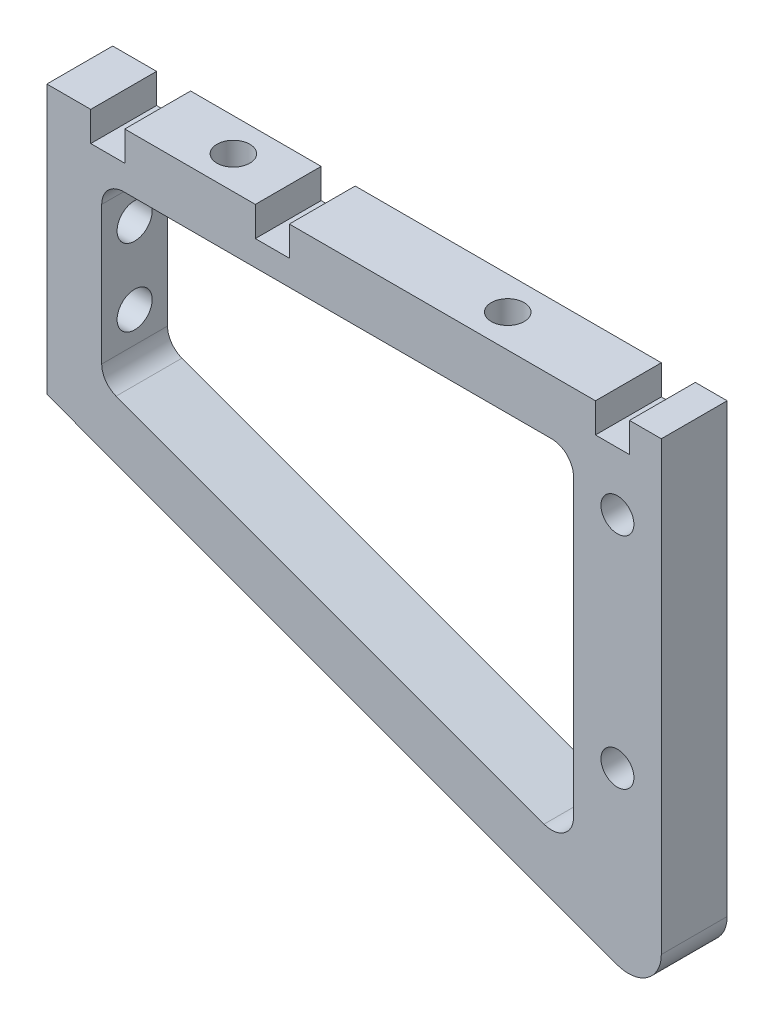
from build123d import *

# Parameters (mm, degrees)
SKETCH_1_R          = 1.5
EXTRUDE_1_DEPTH     = 6
FILLET_1_R          = 3
CUT_EXTRUDE_1_REACH = 73.29
SKETCH_2_R          = 1.5
SKETCH_3_W          = 3.1
SKETCH_3_H          = 2.7
CUT_EXTRUDE_2_DEPTH = 73.090221251
FILLET_2_R          = 2
SKETCH_4_R          = 1.6
CUT_EXTRUDE_3_DEPTH = 69.27884006


with BuildPart() as part:
    # 草图1 → 凸台-拉伸1 (new body)
    with BuildSketch(Plane.XY):
        Polygon((0, 0), (0, 45), (-56, 45), (-56, 42.266964597), (-56, 20.506230936), (-51.898147584, 19.004203562), align=None)
        with Locations((-4, 37)):
            Circle(SKETCH_1_R, mode=Mode.SUBTRACT)
        with Locations((-4, 17)):
            Circle(SKETCH_1_R, mode=Mode.SUBTRACT)
        Polygon((-51, 40), (-51, 24), (-45.845984401, 22.112688677), (-8, 8.254144103), (-8, 40), (-49, 40), align=None, mode=Mode.SUBTRACT)
    extrude(amount=EXTRUDE_1_DEPTH)

    # 圆角1
    fillet_1_edges = [part.edges().sort_by_distance(p)[0] for p in [
        (0, 0, 3),
    ]]
    fillet(fillet_1_edges, radius=FILLET_1_R)

    # 草图2 → 切除-拉伸1 (cut, up to next)
    with BuildSketch(Plane(origin=(0, 45, 0), x_dir=(1, 0, 0), z_dir=(0, 1, 0)), mode=Mode.PRIVATE) as cut_extrude_1_sk1:
        with Locations(Location((-17, -3, 0), (0, 0, 180))):
            Circle(SKETCH_2_R)
    cut_extrude_1_tool1 = extrude(cut_extrude_1_sk1.sketch, amount=-CUT_EXTRUDE_1_REACH, mode=Mode.PRIVATE) & part.part
    # 草图2 → 切除-拉伸1 (cut, up to next)
    with BuildSketch(Plane(origin=(0, 45, 0), x_dir=(1, 0, 0), z_dir=(0, 1, 0)), mode=Mode.PRIVATE) as cut_extrude_1_sk2:
        with Locations(Location((-42, -3, 0), (0, 0, 180))):
            Circle(SKETCH_2_R)
    cut_extrude_1_tool2 = extrude(cut_extrude_1_sk2.sketch, amount=-CUT_EXTRUDE_1_REACH, mode=Mode.PRIVATE) & part.part
    add(cut_extrude_1_tool1.solids().sort_by_distance((-17, 45, 3))[0], mode=Mode.SUBTRACT)
    add(cut_extrude_1_tool2.solids().sort_by_distance((-42, 45, 3))[0], mode=Mode.SUBTRACT)

    # 草图3 → 切除-拉伸2 (cut, through all)
    with BuildSketch(Plane.XY.offset(6)):
        with Locations((-50.45, 43.65)):
            Rectangle(SKETCH_3_W, SKETCH_3_H)
        with Locations((-35.45, 43.65)):
            Rectangle(SKETCH_3_W, SKETCH_3_H)
        with Locations((-4.45, 43.65)):
            Rectangle(SKETCH_3_W, SKETCH_3_H)
    extrude(amount=-CUT_EXTRUDE_2_DEPTH, mode=Mode.SUBTRACT)

    # 圆角2
    fillet_2_edges = [part.edges().sort_by_distance(p)[0] for p in [
        (-51, 40, 3),
        (-51, 24, 3),
        (-8, 8.254144103, 3),
        (-8, 40, 3),
    ]]
    fillet(fillet_2_edges, radius=FILLET_2_R)

    # 草图4 → 切除-拉伸3 (cut, through all)
    with BuildSketch(Plane(origin=(-51, 0, 0), x_dir=(0, 0, -1), z_dir=(1, 0, 0))):
        with Locations((-3, 35.198753813)):
            Circle(SKETCH_4_R)
        with Locations((-3, 28.198753813)):
            Circle(SKETCH_4_R)
    extrude(amount=-CUT_EXTRUDE_3_DEPTH, mode=Mode.SUBTRACT)


solid = part.part
